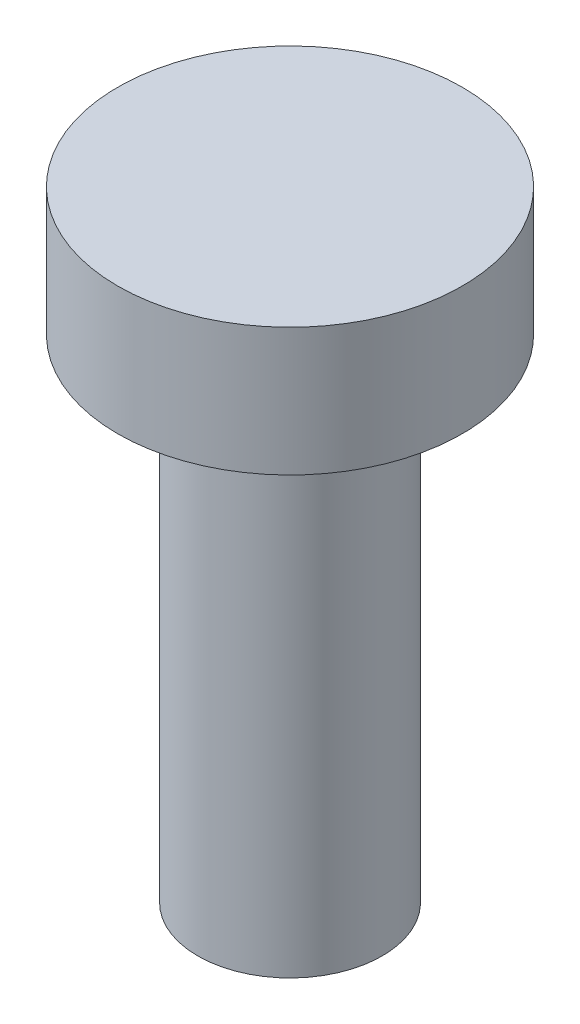
from build123d import *


with BuildPart() as part:
    # Sketch1 → Revolve1 (revolve)
    with BuildSketch(Plane.XY, mode=Mode.PRIVATE) as revolve1_sk:
        Polygon((2.38125, 12.7), (4.445, 12.7), (4.445, 16.002), (0, 16.002), (0, 0), (2.38125, 0), align=None)
    revolve(revolve1_sk.sketch.rotate(Axis((0, 12.7, 0), (0, -1, 0)), 90), axis=Axis((0, 12.7, 0), (0, -1, 0)))


solid = part.part
